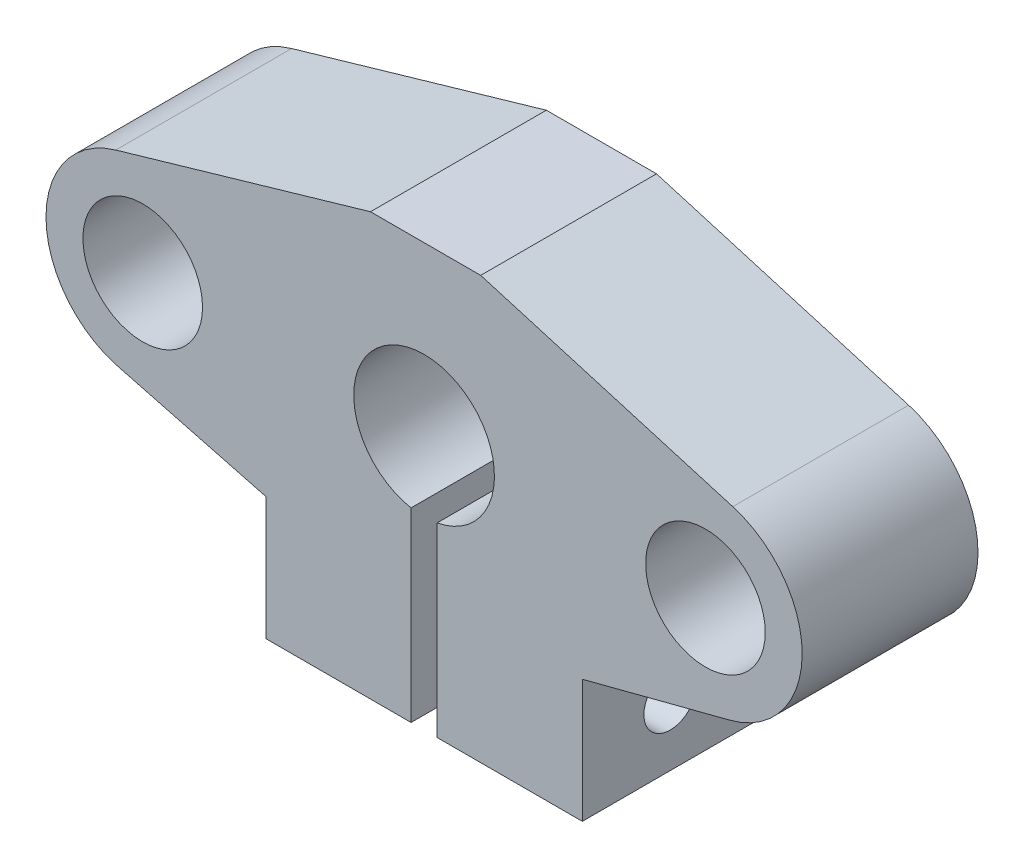
from build123d import *

# Parameters (mm, degrees)
SKETCH2_R           = 3.4
BOSS_EXTRUDE2_DEPTH = 10
SKETCH3_R           = 1.5
CUT_EXTRUDE1_DEPTH  = 30


with BuildPart() as part:
    # Sketch2 → Boss-Extrude2 (new body)
    with BuildSketch(Plane.XY):
        with BuildLine():
            Line((-3.046772292, 9.5), (3.21957788, 9.5))
            Line((3.21957788, 9.5), (17.554684003, 5.275299758))
            ThreePointArc((17.554684003, 5.275299758), (21.498894584, -0.089376976), (17.382422577, -5.32303839))
            Line((17.382422577, -5.32303839), (9, -7.5))
            Line((9, -7.5), (9, -14.5))
            Line((9, -14.5), (0.740403033, -14.5))
            Line((0.740403033, -14.5), (0.740403033, -3.930878191))
            ThreePointArc((0.740403033, -3.930878191), (0, 4), (-0.740403033, -3.930878191))
            Line((-0.740403033, -3.930878191), (-0.740403033, -14.5))
            Line((-0.740403033, -14.5), (-9, -14.5))
            Line((-9, -14.5), (-9, -7.5))
            Line((-9, -7.5), (-17.597446952, -5.249385871))
            ThreePointArc((-17.597446952, -5.249385871), (-21.499891691, 0.047111305), (-17.533036453, 5.295541242))
            Line((-17.533036453, 5.295541242), (-3.046772292, 9.5))
        make_face()
        with Locations((-15.99999429, 0.013516845)):
            Circle(SKETCH2_R, mode=Mode.SUBTRACT)
        with Locations((16, 0)):
            Circle(SKETCH2_R, mode=Mode.SUBTRACT)
    extrude(amount=BOSS_EXTRUDE2_DEPTH)

    # Sketch3 → Cut-Extrude1 (cut)
    with BuildSketch(Plane.ZY.offset(9)):
        with Locations((5, -11)):
            Circle(SKETCH3_R)
    extrude(amount=-CUT_EXTRUDE1_DEPTH, mode=Mode.SUBTRACT)


solid = part.part
